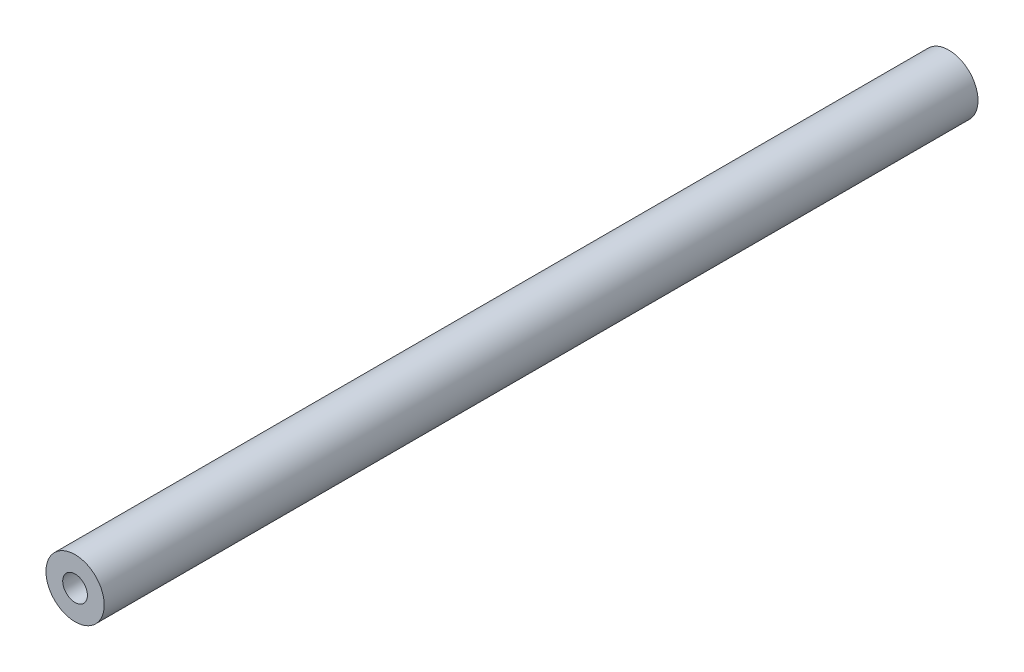
from build123d import *

# Parameters (mm, degrees)
SKETCH1_R                            = 4.7625
BOSS_EXTRUDE1_DEPTH                  = 71.4375
F_10_32_TAPPED_HOLE1_D               = 4.0386
F_10_32_TAPPED_HOLE1_DEPTH           = 11.938
F_10_32_TAPPED_HOLE1_TIP             = 1.213317848
F_10_32_TAPPED_HOLE1_ON_FACE_2_D     = 4.0386
F_10_32_TAPPED_HOLE1_ON_FACE_2_DEPTH = 11.938
F_10_32_TAPPED_HOLE1_ON_FACE_2_TIP   = 1.213317848


with BuildPart() as part:
    # Sketch1 → Boss-Extrude1 (new, symmetric)
    with BuildSketch(Plane.XY):
        Circle(SKETCH1_R)
    extrude(amount=BOSS_EXTRUDE1_DEPTH, both=True)

    # #10-32 Tapped Hole1
    with Locations(Plane.XY.offset(71.4375)):
        with Locations((0, 0)):
            Hole(F_10_32_TAPPED_HOLE1_D / 2, depth=F_10_32_TAPPED_HOLE1_DEPTH)
            with Locations((0, 0, -(F_10_32_TAPPED_HOLE1_DEPTH + F_10_32_TAPPED_HOLE1_TIP / 2))):  # 118° drill point
                Cone(0, F_10_32_TAPPED_HOLE1_D / 2, F_10_32_TAPPED_HOLE1_TIP, mode=Mode.SUBTRACT)

    # #10-32 Tapped Hole1 on face 2
    with Locations(Plane(origin=(0, 0, -71.4375), x_dir=(-1, 0, 0), z_dir=(0, 0, -1))):
        with Locations((0, 0)):
            Hole(F_10_32_TAPPED_HOLE1_ON_FACE_2_D / 2, depth=F_10_32_TAPPED_HOLE1_ON_FACE_2_DEPTH)
            with Locations((0, 0, -(F_10_32_TAPPED_HOLE1_ON_FACE_2_DEPTH + F_10_32_TAPPED_HOLE1_ON_FACE_2_TIP / 2))):  # 118° drill point
                Cone(0, F_10_32_TAPPED_HOLE1_ON_FACE_2_D / 2, F_10_32_TAPPED_HOLE1_ON_FACE_2_TIP, mode=Mode.SUBTRACT)


solid = part.part
